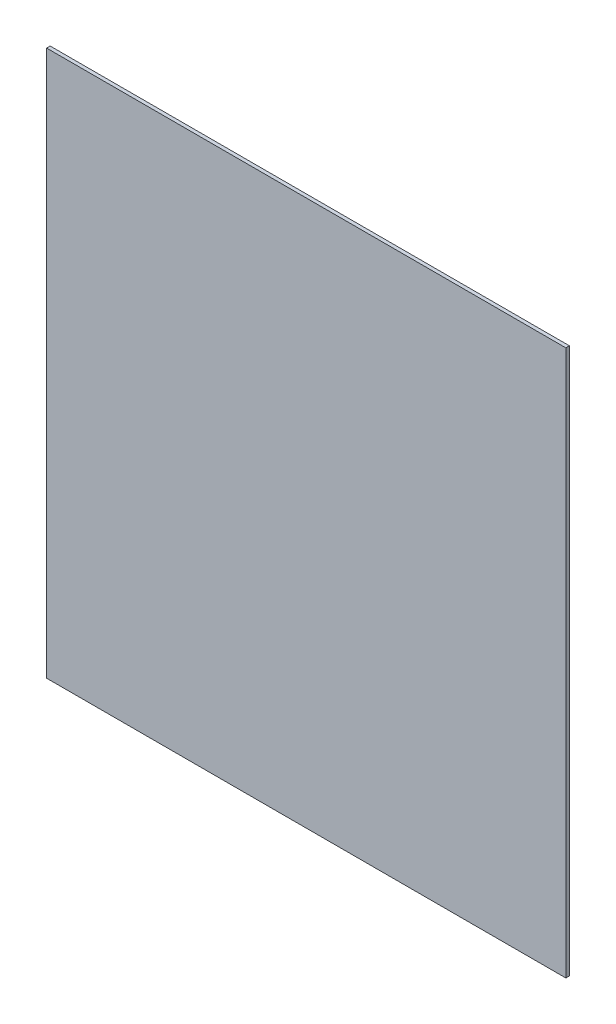
from build123d import *

# Parameters (mm, degrees)
SKETCH1_W           = 437.65
SKETCH1_H           = 460
BOSS_EXTRUDE1_DEPTH = 3


with BuildPart() as part:
    # Sketch1 → Boss-Extrude1 (new body)
    with BuildSketch(Plane.XY):
        with Locations((218.825, 230)):
            Rectangle(SKETCH1_W, SKETCH1_H)
    extrude(amount=BOSS_EXTRUDE1_DEPTH)


solid = part.part
